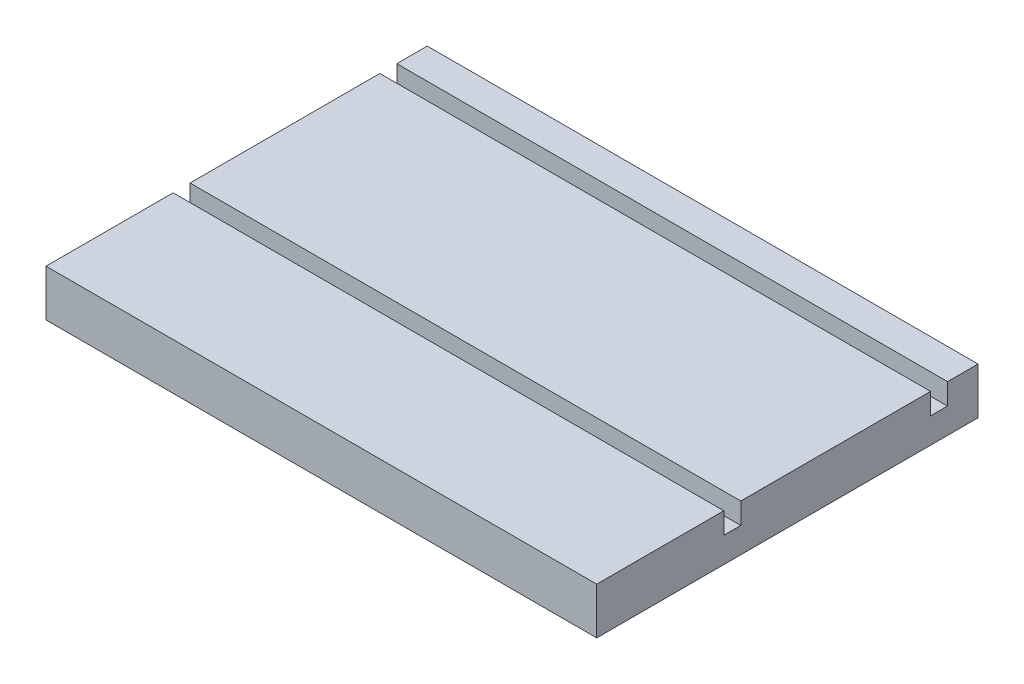
from build123d import *

# Parameters (mm, degrees)
SKETCH1_W           = 650
SKETCH1_H           = 450
BOSS_EXTRUDE1_DEPTH = 55
SKETCH2_W           = 20
SKETCH2_H           = 25
CUT_EXTRUDE1_DEPTH  = 793.480283666


with BuildPart() as part:
    # Sketch1 → Boss-Extrude1 (new body)
    with BuildSketch(Plane(origin=(0, 0, 0), x_dir=(1, 0, 0), z_dir=(0, 1, 0))):
        with Locations((325, 225)):
            Rectangle(SKETCH1_W, SKETCH1_H)
    extrude(amount=BOSS_EXTRUDE1_DEPTH)

    # Sketch2 → Cut-Extrude1 (cut, through all)
    with BuildSketch(Plane(origin=(650, 0, 0), x_dir=(0, 0, -1), z_dir=(1, 0, 0))):
        with Locations((404, 42.5)):
            Rectangle(SKETCH2_W, SKETCH2_H)
        with Locations((160, 42.5)):
            Rectangle(SKETCH2_W, SKETCH2_H)
    extrude(amount=-CUT_EXTRUDE1_DEPTH, mode=Mode.SUBTRACT)


solid = part.part
